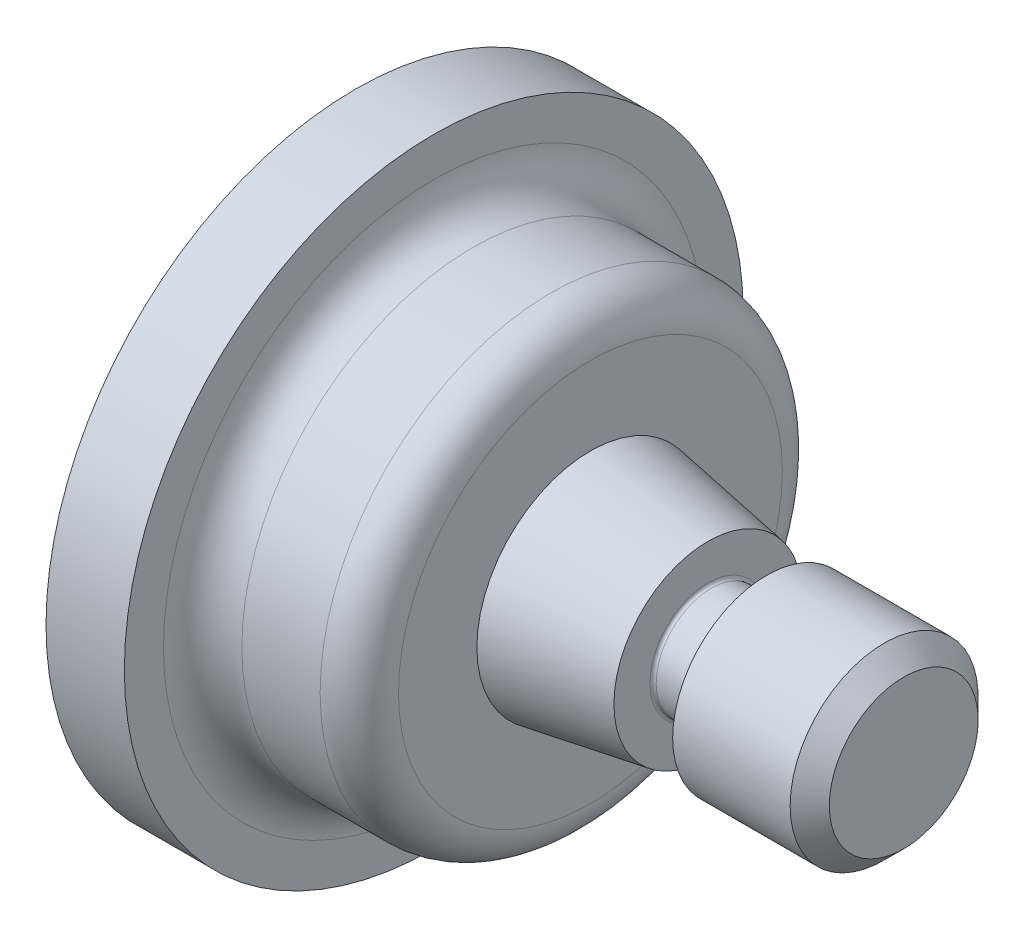
from build123d import *


with BuildPart() as part:
    # Sketch1 → Base-Revolve (revolve)
    with BuildSketch(Plane.XY, mode=Mode.PRIVATE) as base_revolve_sk:
        with BuildLine():
            Line((-88.899984186, 50.165), (-76.198738953, 50.165))
            Line((-76.198738953, 50.165), (-76.198738953, 43.815))
            ThreePointArc((-76.198738953, 43.815), (-74.339229418, 39.325746861), (-69.849976278, 37.466237326))
            Line((-69.849976278, 37.466237326), (-57.15, 37.466237326))
            ThreePointArc((-57.15, 37.466237326), (-52.658991427, 35.606000666), (-50.798754767, 31.114992093))
            Line((-50.798754767, 31.114992093), (-50.798754767, 18.414784554))
            Line((-50.798754767, 18.414784554), (-31.75, 15.239992093))
            Line((-31.75, 15.239992093), (-31.75, 9.397992093))
            ThreePointArc((-31.75, 9.397992093), (-31.601210245, 9.038781848), (-31.242, 8.889992093))
            Line((-31.242, 8.889992093), (-22.733, 8.889992093))
            ThreePointArc((-22.733, 8.889992093), (-22.373789755, 9.038781848), (-22.225, 9.397992093))
            Line((-22.225, 9.397992093), (-22.225, 15.239992093))
            Line((-22.225, 15.239992093), (-3.175, 15.239992093))
            Line((-3.175, 15.239992093), (0, 12.064992093))
            Line((0, 12.064992093), (0, 0))
            Line((0, 0), (-88.899984186, 0))
            Line((-88.899984186, 0), (-88.899984186, 50.165))
        make_face()
    revolve(base_revolve_sk.sketch.rotate(Axis((0, 0, 0), (1, 0, 0)), 90), axis=Axis((0, 0, 0), (1, 0, 0)))


solid = part.part
